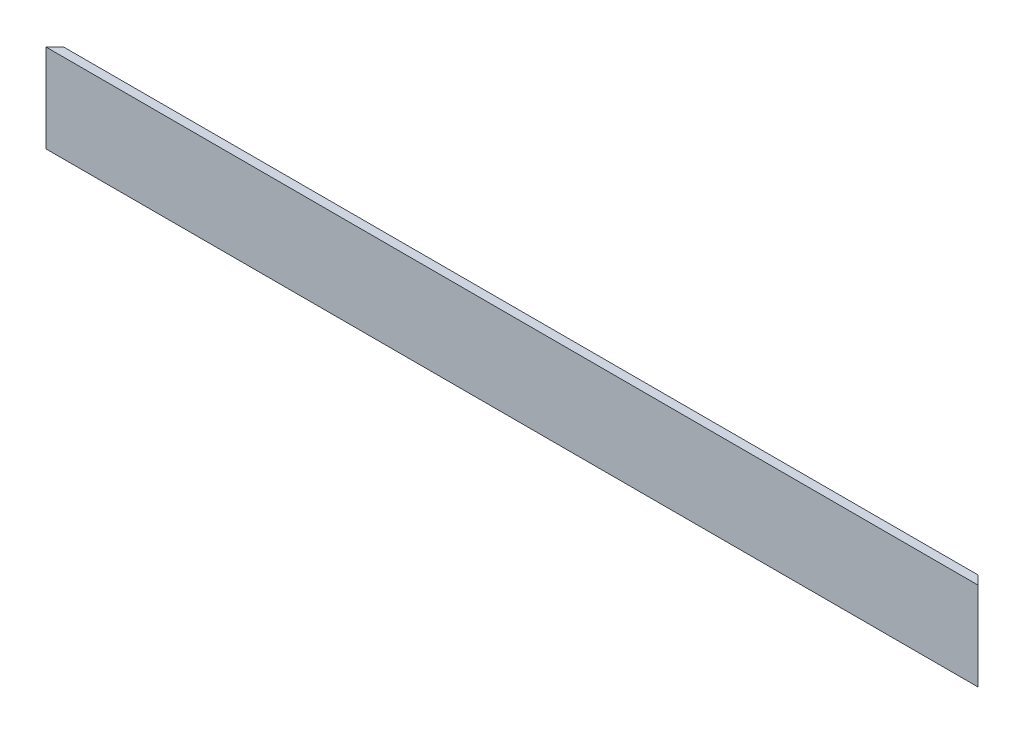
from build123d import *

# Parameters (mm, degrees)
CROQUIS1_W              = 1056
CROQUIS1_H              = 10
SALIENTE_EXTRUIR1_DEPTH = 100
CORTAR_EXTRUIR1_DEPTH   = 100
CROQUIS3_W              = 1056
CROQUIS3_H              = 97.5
CORTAR_EXTRUIR2_DEPTH   = 8


with BuildPart() as part:
    # Croquis1 → Saliente-Extruir1 (new body)
    with BuildSketch(Plane(origin=(0, 0, 0), x_dir=(1, 0, 0), z_dir=(0, 1, 0))):
        Rectangle(CROQUIS1_W, CROQUIS1_H)
    extrude(amount=SALIENTE_EXTRUIR1_DEPTH)

    # Croquis2 → Cortar-Extruir1 (cut)
    with BuildSketch(Plane(origin=(0, 100, 0), x_dir=(1, 0, 0), z_dir=(0, 1, 0))):
        Polygon((-528, -5), (-518, 5), (-528, 5), align=None)
        Polygon((518, 5), (528, 5), (528, -5), align=None)
    extrude(amount=-CORTAR_EXTRUIR1_DEPTH, mode=Mode.SUBTRACT)

    # Croquis3 → Cortar-Extruir2 (cut)
    with BuildSketch(Plane(origin=(0, 0, -5), x_dir=(-1, 0, 0), z_dir=(0, 0, -1))):
        with Locations((0, 50)):
            Rectangle(CROQUIS3_W, CROQUIS3_H)
    extrude(amount=-CORTAR_EXTRUIR2_DEPTH, mode=Mode.SUBTRACT)


solid = part.part
